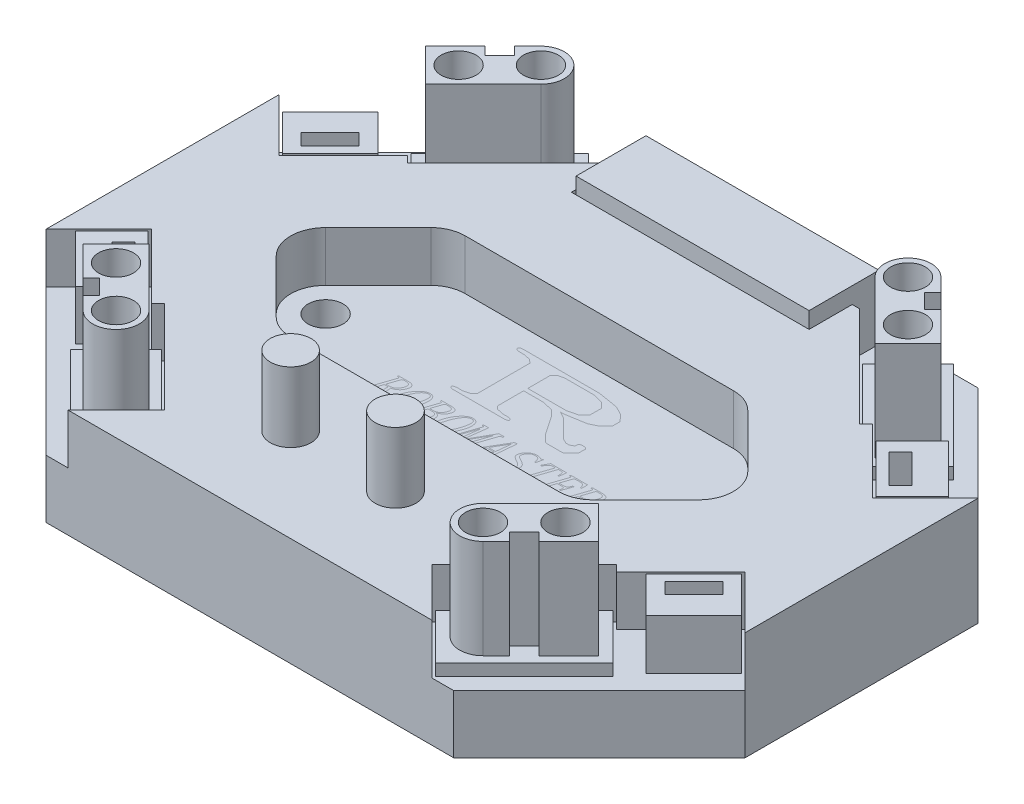
from build123d import *

# Parameters (mm, degrees)
SKETCH_1_R          = 1.5
EXTRUDE_1_DEPTH     = 5
SKETCH_2_R          = 1.5
EXTRUDE_2_DEPTH     = 9.5
CUT_EXTRUDE_1_DEPTH = 8.5
EXTRUDE_3_DEPTH     = 4.3
SKETCH_6_W          = 20
SKETCH_6_H          = 6
EXTRUDE_4_DEPTH     = 5.5
EXTRUDE_5_DEPTH     = 4.3
SKETCH_8_R          = 1.75
EXTRUDE_6_DEPTH     = 6


with BuildPart() as part:
    # 草图1 → 凸台-拉伸1 (new body)
    with BuildSketch(Plane(origin=(0, 0, 0), x_dir=(1, 0, 0), z_dir=(0, 1, 0))):
        Polygon((-30, 10), (-17.5, 22.5), (17.5, 22.5), (30, 10), (30, -10), (17.5, -22.5), (-17.5, -22.5), (-30, -10), align=None)
        with Locations(Location((-16, 0, 0), (0, 0, 270))):
            Circle(SKETCH_1_R, mode=Mode.SUBTRACT)
        with Locations(Location((16, 0, 0), (0, 0, 270))):
            Circle(SKETCH_1_R, mode=Mode.SUBTRACT)
    extrude(amount=EXTRUDE_1_DEPTH)

    # 草图2 → 凸台-拉伸2 (add)
    # profile 1 of 4: a face of its own
    with BuildSketch(Plane(origin=(0, 5, 0), x_dir=(1, 0, 0), z_dir=(0, 1, 0))):
        Polygon((-23.282485579, 14.596194078), (-19.393398282, 10.707106781), (-11.756645045, 18.343860018), (-15.645732342, 22.232947315), align=None)
        with Locations(Location((-15.751798359, 18.237794001, 0), (0, 0, 270))):
            Circle(SKETCH_2_R, mode=Mode.SUBTRACT)
        with Locations(Location((-19.287332265, 14.702260095, 0), (0, 0, 270))):
            Circle(SKETCH_2_R, mode=Mode.SUBTRACT)
    # profile 2 of 4: a face of its own
    with BuildSketch(Plane(origin=(0, 5, 0), x_dir=(1, 0, 0), z_dir=(0, 1, 0))):
        Polygon((15.645732342, 22.232947315), (11.756645045, 18.343860018), (19.393398282, 10.707106781), (23.282485579, 14.596194078), align=None)
        with Locations(Location((19.287332265, 14.702260095, 0), (0, 0, 90))):
            Circle(SKETCH_2_R, mode=Mode.SUBTRACT)
        with Locations(Location((15.751798359, 18.237794001, 0), (0, 0, 90))):
            Circle(SKETCH_2_R, mode=Mode.SUBTRACT)
    # profile 3 of 4: a face of its own
    with BuildSketch(Plane(origin=(0, 5, 0), x_dir=(1, 0, 0), z_dir=(0, 1, 0))):
        Polygon((23.282485579, -14.596194078), (19.393398282, -10.707106781), (11.756645045, -18.343860018), (15.645732342, -22.232947315), align=None)
        with Locations(Location((15.751798359, -18.237794001, 0), (0, 0, 270))):
            Circle(SKETCH_2_R, mode=Mode.SUBTRACT)
        with Locations(Location((19.287332265, -14.702260095, 0), (0, 0, 270))):
            Circle(SKETCH_2_R, mode=Mode.SUBTRACT)
    # profile 4 of 4: a face of its own
    with BuildSketch(Plane(origin=(0, 5, 0), x_dir=(1, 0, 0), z_dir=(0, 1, 0))):
        Polygon((-15.645732342, -22.232947315), (-11.756645045, -18.343860018), (-19.393398282, -10.707106781), (-23.282485579, -14.596194078), align=None)
        with Locations(Location((-19.287332265, -14.702260095, 0), (0, 0, 90))):
            Circle(SKETCH_2_R, mode=Mode.SUBTRACT)
        with Locations(Location((-15.751798359, -18.237794001, 0), (0, 0, 90))):
            Circle(SKETCH_2_R, mode=Mode.SUBTRACT)
    extrude(amount=EXTRUDE_2_DEPTH)

    # 草图3 → 切除-拉伸1 (cut)
    # profile 1 of 4: a face of its own
    with BuildSketch(Plane(origin=(0, 14.5, 0), x_dir=(1, 0, 0), z_dir=(0, 1, 0))):
        Polygon((-15.645732342, 22.232947315), (-23.282485579, 14.596194078), (-19.393398282, 10.707106781), (-11.756645045, 18.343860018), align=None)
        with BuildLine():
            Line((-14.337584797, 16.823580438), (-19.287332265, 11.87383297))
            Line((-19.287332265, 11.87383297), (-22.11575939, 14.702260095))
            Line((-22.11575939, 14.702260095), (-19.570174977, 17.247844507))
            Line((-19.570174977, 17.247844507), (-18.863068196, 16.540737726))
            Line((-18.863068196, 16.540737726), (-17.59027599, 17.813529932))
            Line((-17.59027599, 17.813529932), (-18.297382771, 18.520636713))
            Line((-18.297382771, 18.520636713), (-17.166011921, 19.652007563))
            ThreePointArc((-17.166011921, 19.652007563), (-14.337584797, 19.652007563), (-14.337584797, 16.823580438))
        make_face(mode=Mode.SUBTRACT)
    # profile 2 of 4: a face of its own
    with BuildSketch(Plane(origin=(0, 14.5, 0), x_dir=(1, 0, 0), z_dir=(0, 1, 0))):
        Polygon((11.756645045, 18.343860018), (15.645732342, 22.232947315), (23.282485579, 14.596194078), (19.393398282, 10.707106781), align=None)
        with BuildLine():
            Line((18.297382771, 18.520636713), (17.166011921, 19.652007563))
            ThreePointArc((17.166011921, 19.652007563), (14.337584797, 19.652007563), (14.337584797, 16.823580438))
            Line((14.337584797, 16.823580438), (19.287332265, 11.87383297))
            Line((19.287332265, 11.87383297), (22.11575939, 14.702260095))
            Line((22.11575939, 14.702260095), (19.570174977, 17.247844507))
            Line((19.570174977, 17.247844507), (18.863068196, 16.540737726))
            Line((18.863068196, 16.540737726), (17.59027599, 17.813529932))
            Line((17.59027599, 17.813529932), (18.297382771, 18.520636713))
        make_face(mode=Mode.SUBTRACT)
    # profile 3 of 4: a face of its own
    with BuildSketch(Plane(origin=(0, 14.5, 0), x_dir=(1, 0, 0), z_dir=(0, 1, 0))):
        Polygon((15.645732342, -22.232947315), (23.282485579, -14.596194078), (19.393398282, -10.707106781), (11.756645045, -18.343860018), align=None)
        with BuildLine():
            Line((14.337584797, -16.823580438), (19.287332265, -11.87383297))
            Line((19.287332265, -11.87383297), (22.11575939, -14.702260095))
            Line((22.11575939, -14.702260095), (19.570174977, -17.247844507))
            Line((19.570174977, -17.247844507), (18.863068196, -16.540737726))
            Line((18.863068196, -16.540737726), (17.59027599, -17.813529932))
            Line((17.59027599, -17.813529932), (18.297382771, -18.520636713))
            Line((18.297382771, -18.520636713), (17.166011921, -19.652007563))
            ThreePointArc((17.166011921, -19.652007563), (14.337584797, -19.652007563), (14.337584797, -16.823580438))
        make_face(mode=Mode.SUBTRACT)
    # profile 4 of 4: a face of its own
    with BuildSketch(Plane(origin=(0, 14.5, 0), x_dir=(1, 0, 0), z_dir=(0, 1, 0))):
        Polygon((-11.756645045, -18.343860018), (-15.645732342, -22.232947315), (-23.282485579, -14.596194078), (-19.393398282, -10.707106781), align=None)
        with BuildLine():
            Line((-18.297382771, -18.520636713), (-17.166011921, -19.652007563))
            ThreePointArc((-17.166011921, -19.652007563), (-14.337584797, -19.652007563), (-14.337584797, -16.823580438))
            Line((-14.337584797, -16.823580438), (-19.287332265, -11.87383297))
            Line((-19.287332265, -11.87383297), (-22.11575939, -14.702260095))
            Line((-22.11575939, -14.702260095), (-19.570174977, -17.247844507))
            Line((-19.570174977, -17.247844507), (-18.863068196, -16.540737726))
            Line((-18.863068196, -16.540737726), (-17.59027599, -17.813529932))
            Line((-17.59027599, -17.813529932), (-18.297382771, -18.520636713))
        make_face(mode=Mode.SUBTRACT)
    extrude(amount=-CUT_EXTRUDE_1_DEPTH, mode=Mode.SUBTRACT)

    # 草图4 → 凸台-拉伸3 (add)
    # profile 1 of 4: a face of its own
    with BuildSketch(Plane(origin=(0, 5, 0), x_dir=(1, 0, 0), z_dir=(0, 1, 0))):
        Polygon((-28.585786438, 8.86862915), (-24.484567107, 12.969848481), (-21.37329727, 9.858578644), (-25.4745166, 5.757359313), align=None)
        Polygon((-26.216978721, 8.12616703), (-23.742104986, 10.601040764), (-22.752155493, 9.61109127), (-25.227029227, 7.136217536), align=None, mode=Mode.SUBTRACT)
    # profile 2 of 4: a face of its own
    with BuildSketch(Plane(origin=(0, 5, 0), x_dir=(1, 0, 0), z_dir=(0, 1, 0))):
        Polygon((25.4745166, 5.757359313), (21.37329727, 9.858578644), (24.484567107, 12.969848481), (28.585786438, 8.86862915), align=None)
        Polygon((25.227029227, 7.136217536), (22.752155493, 9.61109127), (23.742104986, 10.601040764), (26.216978721, 8.12616703), align=None, mode=Mode.SUBTRACT)
    # profile 3 of 4: a face of its own
    with BuildSketch(Plane(origin=(0, 5, 0), x_dir=(1, 0, 0), z_dir=(0, 1, 0))):
        Polygon((28.585786438, -8.86862915), (24.484567107, -12.969848481), (21.37329727, -9.858578644), (25.4745166, -5.757359313), align=None)
        Polygon((26.216978721, -8.12616703), (23.742104986, -10.601040764), (22.752155493, -9.61109127), (25.227029227, -7.136217536), align=None, mode=Mode.SUBTRACT)
    # profile 4 of 4: a face of its own
    with BuildSketch(Plane(origin=(0, 5, 0), x_dir=(1, 0, 0), z_dir=(0, 1, 0))):
        Polygon((-25.4745166, -5.757359313), (-21.37329727, -9.858578644), (-24.484567107, -12.969848481), (-28.585786438, -8.86862915), align=None)
        Polygon((-25.227029227, -7.136217536), (-22.752155493, -9.61109127), (-23.742104986, -10.601040764), (-26.216978721, -8.12616703), align=None, mode=Mode.SUBTRACT)
    extrude(amount=EXTRUDE_3_DEPTH)

    # 草图6 → 凸台-拉伸4 (add)
    with BuildSketch(Plane(origin=(0, 5, 0), x_dir=(1, 0, 0), z_dir=(0, 1, 0))):
        with Locations((0, 18.5)):
            Rectangle(SKETCH_6_W, SKETCH_6_H)
    extrude(amount=EXTRUDE_4_DEPTH)

    # 草图5 → 凸台-拉伸5 (add)
    with BuildSketch(Plane(origin=(0, 5, 0), x_dir=(1, 0, 0), z_dir=(0, 1, 0))):
        Polygon((-30, 10), (-30, -10), (-25.4745166, -5.4745166), (-19.959083707, -10.989949494), (-19.393398282, -10.424264069), (-11.473802333, -18.343860018), (-15.629942315, -22.5), (15.629942315, -22.5), (11.473802333, -18.343860018), (19.393398282, -10.424264069), (19.959083707, -10.989949494), (25.4745166, -5.4745166), (30, -10), (30, 10), (25.4745166, 5.4745166), (19.959083707, 10.989949494), (19.393398282, 10.424264069), (10.817662351, 19), (10.2, 19), (10.2, 15.3), (-10.2, 15.3), (-10.2, 19), (-10.817662351, 19), (-19.393398282, 10.424264069), (-19.959083707, 10.989949494), (-25.4745166, 5.4745166), align=None)
        with BuildLine():
            Line((-18.121320344, 2.121320344), (-13.604055577, 6.63858511))
            ThreePointArc((-13.604055577, 6.63858511), (-12.649908859, 7.276125564), (-11.524416066, 7.5))
            Line((-11.524416066, 7.5), (11.524416066, 7.5))
            ThreePointArc((11.524416066, 7.5), (12.649908859, 7.276125564), (13.604055577, 6.63858511))
            Line((13.604055577, 6.63858511), (18.121320344, 2.121320344))
            ThreePointArc((18.121320344, 2.121320344), (19, 0), (18.121320344, -2.121320344))
            Line((18.121320344, -2.121320344), (13.604055577, -6.63858511))
            ThreePointArc((13.604055577, -6.63858511), (12.649908859, -7.276125564), (11.524416066, -7.5))
            Line((11.524416066, -7.5), (-11.524416066, -7.5))
            ThreePointArc((-11.524416066, -7.5), (-12.649908859, -7.276125564), (-13.604055577, -6.63858511))
            Line((-13.604055577, -6.63858511), (-18.121320344, -2.121320344))
            ThreePointArc((-18.121320344, -2.121320344), (-19, 0), (-18.121320344, 2.121320344))
        make_face(mode=Mode.SUBTRACT)
    extrude(amount=EXTRUDE_5_DEPTH)

    # 草图8 → 凸台-拉伸6 (add)
    with BuildSketch(Plane(origin=(0, 9.3, 0), x_dir=(1, 0, 0), z_dir=(0, 1, 0))):
        with Locations(Location((-4.5, -14.5, 0), (0, 0, 270))):
            Circle(SKETCH_8_R)
        with Locations(Location((4.5, -14.5, 0), (0, 0, 270))):
            Circle(SKETCH_8_R)
    extrude(amount=EXTRUDE_6_DEPTH)


solid = part.part
